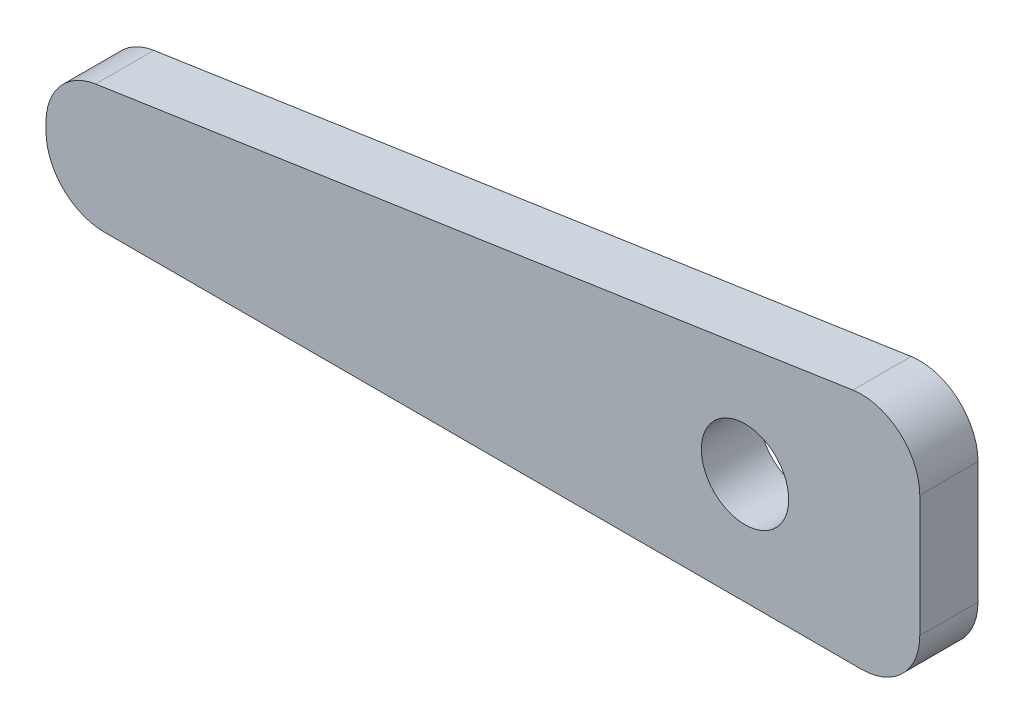
from build123d import *

# Parameters (mm, degrees)
BOSS_EXTRUDE1_DEPTH = 3.175


with BuildPart() as part:
    # Sketch1 → Boss-Extrude1 (new body)
    with BuildSketch(Plane.XY):
        with BuildLine():
            Line((-381, 3.615729939), (-381, 3.175))
            ThreePointArc((-381, 3.175), (-380.07006403, 0.92993597), (-377.825, 0))
            Line((-377.825, 0), (-342.9, 0))
            Line((-342.9, 0), (-342.9, 3.65125))
            ThreePointArc((-342.9, 3.65125), (-345.28125, 6.0325), (-342.9, 8.41375))
            Line((-342.9, 8.41375), (-342.9, 12.065))
            Line((-342.9, 12.065), (-378.295980938, 6.755602859))
            ThreePointArc((-378.295980938, 6.755602859), (-380.230825168, 5.68759631), (-381, 3.615729939))
        make_face()
        with BuildLine():
            Line((-342.9, 3.65125), (-342.9, 0))
            Line((-342.9, 0), (-336.55, 0))
            ThreePointArc((-336.55, 0), (-334.30493597, 0.92993597), (-333.375, 3.175))
            Line((-333.375, 3.175), (-333.375, 9.806979939))
            ThreePointArc((-333.375, 9.806979939), (-334.478133629, 12.212805107), (-337.020980938, 12.946852859))
            Line((-337.020980938, 12.946852859), (-342.9, 12.065))
            Line((-342.9, 12.065), (-342.9, 8.41375))
            ThreePointArc((-342.9, 8.41375), (-341.216201977, 7.716298023), (-340.51875, 6.0325))
            ThreePointArc((-340.51875, 6.0325), (-341.216201977, 4.348701977), (-342.9, 3.65125))
        make_face()
    extrude(amount=BOSS_EXTRUDE1_DEPTH)


solid = part.part
